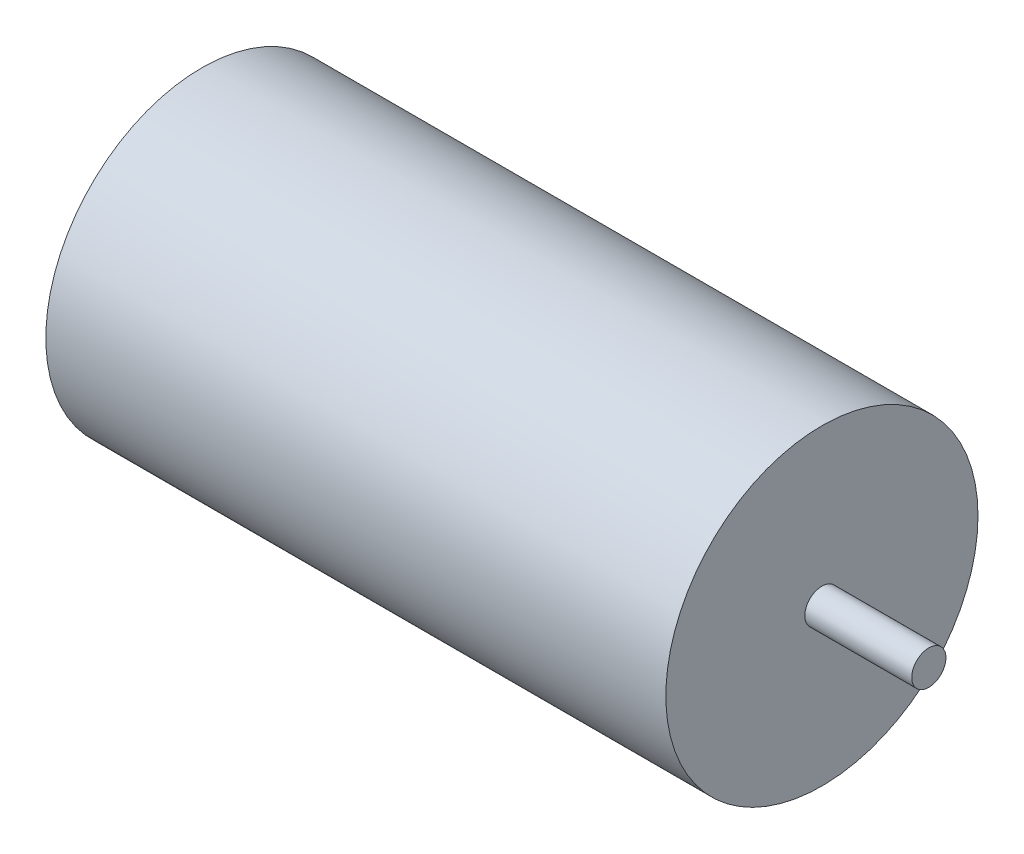
from build123d import *

# Parameters (mm, degrees)
SKETCH1_R                = 36.5
SKETCH1_R_2              = 4
BOSS_EXTRUDE1_DEPTH      = 145
BOSS_EXTRUDE2_DEPTH      = 170
BOSS_EXTRUDE2_DEPTH_BACK = 22
SKETCH1_3_R              = 4


with BuildPart() as part:
    # Sketch1 → Boss-Extrude1 (new body)
    with BuildSketch(Plane(origin=(0, 0, 0), x_dir=(0, 0, -1), z_dir=(1, 0, 0))):
        Circle(SKETCH1_R)
        Circle(SKETCH1_R_2, mode=Mode.SUBTRACT)
    extrude(amount=BOSS_EXTRUDE1_DEPTH)

    # Sketch1<3> → Boss-Extrude2 (add, two sides: drawn at the far end of the back side and taken through both)
    with BuildSketch(Plane(origin=(0, 0, 0), x_dir=(0, 0, -1), z_dir=(1, 0, 0)).offset(-BOSS_EXTRUDE2_DEPTH_BACK)):
        Circle(SKETCH1_3_R)
    extrude(amount=BOSS_EXTRUDE2_DEPTH + BOSS_EXTRUDE2_DEPTH_BACK)


solid = part.part
